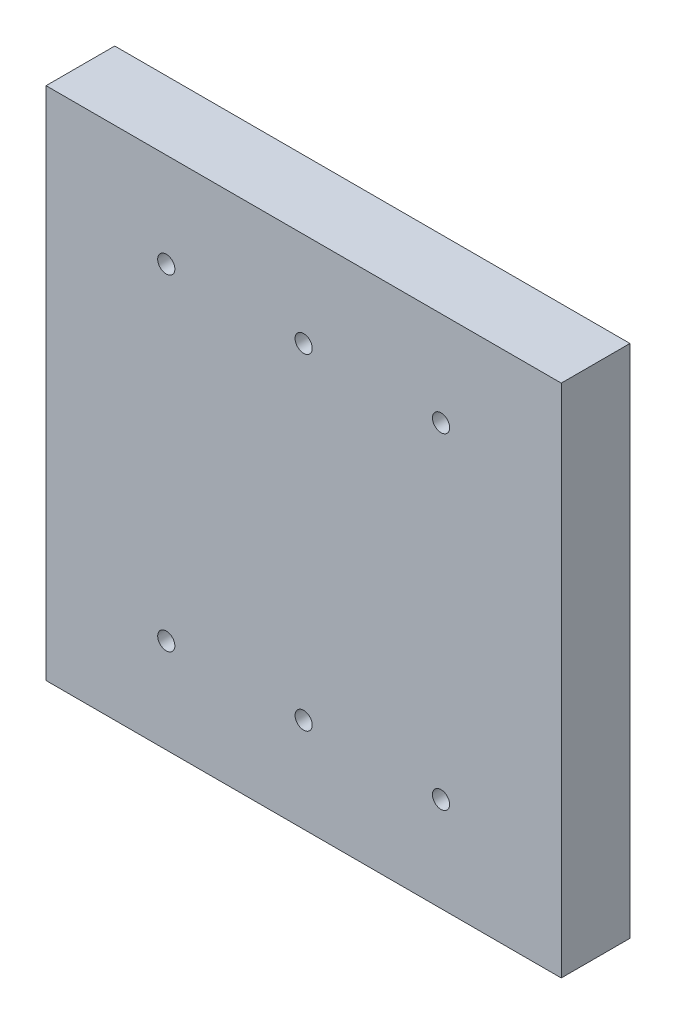
from build123d import *

# Parameters (mm, degrees)
SKETCH1_W               = 300
SKETCH1_H               = 300
BOSS_EXTRUDE1_DEPTH     = 10
BOSS_EXTRUDE4_DEPTH     = 30
CUT_EXTRUDE2_DEPTH      = 215.242852856
CUT_EXTRUDE2_DEPTH_BACK = 215.242852856
SKETCH1_11_R            = 5


with BuildPart() as part:
    # Sketch1 → Boss-Extrude1 (new body)
    with BuildSketch(Plane.XY):
        Rectangle(SKETCH1_W, SKETCH1_H)
    extrude(amount=BOSS_EXTRUDE1_DEPTH)

    # Sketch1<6> → Boss-Extrude4 (add)
    with BuildSketch(Plane.XY):
        Polygon((-120, 150), (-150, 150), (-150, -150), (150, -150), (150, 150), align=None)
        Polygon((120, 0), (120, -120), (0, -120), (-120, -120), (-120, 120), (-55.80388173, 120), (0, 120), (120, 120), align=None, mode=Mode.SUBTRACT)
    extrude(amount=-BOSS_EXTRUDE4_DEPTH)

    # Sketch1<11> → Cut-Extrude2 (cut, two sides: drawn at the far end of the back side and taken through both)
    with BuildSketch(Plane.XY.offset(-CUT_EXTRUDE2_DEPTH_BACK)):
        with Locations((80, 95)):
            Circle(SKETCH1_11_R)
        with Locations((-80, 95)):
            Circle(SKETCH1_11_R)
        with Locations((0, 95)):
            Circle(SKETCH1_11_R)
        with Locations((-80, -95)):
            Circle(SKETCH1_11_R)
        with Locations((80, -95)):
            Circle(SKETCH1_11_R)
        with Locations((0, -95)):
            Circle(SKETCH1_11_R)
    extrude(amount=CUT_EXTRUDE2_DEPTH + CUT_EXTRUDE2_DEPTH_BACK, mode=Mode.SUBTRACT)


solid = part.part
